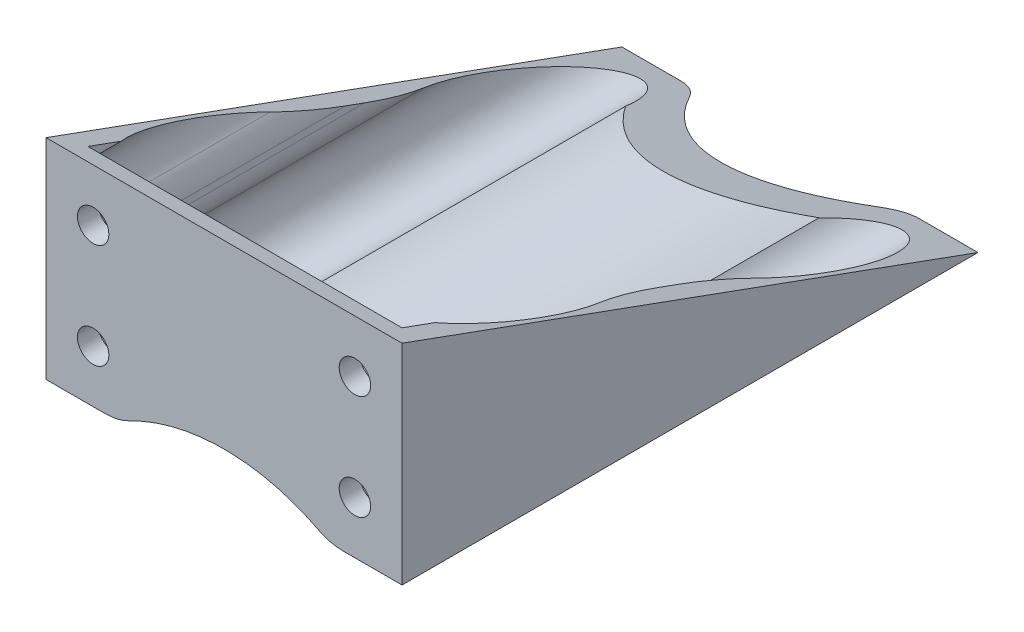
from build123d import *

# Parameters (mm, degrees)
SALIENTE_EXTRUIR3_DEPTH = 34
CROQUIS6_R              = 19.75
CORTAR_EXTRUIR2_DEPTH   = 68.683085036
VACIADO3_T              = -2
CROQUIS5_R              = 1.5
CORTAR_EXTRUIR3_DEPTH   = 10
REDONDEO1_R             = 5
REDONDEO3_R             = 5
CROQUIS10_R             = 4
CORTAR_EXTRUIR7_DEPTH   = 67.068146637
REDONDEO4_R             = 4


with BuildPart() as part:
    # Croquis4 → Saliente-Extruir3 (new body)
    with BuildSketch(Plane(origin=(0, 0, 0), x_dir=(0, 0, -1), z_dir=(1, 0, 0))):
        Polygon((0, 0), (55, 0), (0, 20), align=None)
    extrude(amount=SALIENTE_EXTRUIR3_DEPTH)

    # Croquis6 → Cortar-Extruir2 (cut, through all)
    with BuildSketch(Plane.XY):
        with Locations((17, -17)):
            Circle(CROQUIS6_R)
    extrude(amount=-CORTAR_EXTRUIR2_DEPTH, mode=Mode.SUBTRACT)

    # Vaciado3
    vaciado3_openings = [part.faces().sort_by_distance(p)[0] for p in [
        (17, 10.517691614, -26.076348062),
    ]]
    offset(amount=VACIADO3_T, openings=vaciado3_openings, kind=Kind.INTERSECTION)

    # Croquis5 → Cortar-Extruir3 (cut)
    with BuildSketch(Plane.XY):
        with Locations((4.5, 15)):
            Circle(CROQUIS5_R)
        with Locations((29.5, 15)):
            Circle(CROQUIS5_R)
        with Locations((29.5, 5)):
            Circle(CROQUIS5_R)
        with Locations((4.5, 5)):
            Circle(CROQUIS5_R)
    extrude(amount=-CORTAR_EXTRUIR3_DEPTH, mode=Mode.SUBTRACT)

    # Redondeo1
    redondeo1_edges = [part.edges().sort_by_distance(p)[0] for p in [
        (27.052984631, 0, -27.5),
        (6.947015369, 0, -27.5),
    ]]
    fillet(redondeo1_edges, radius=REDONDEO1_R)

    # Redondeo3
    redondeo3_edges = [part.edges().sort_by_distance(p)[0] for p in [
        (6.41404232, 2, -25.750000004),
        (27.58595768, 2, -25.75),
    ]]
    fillet(redondeo3_edges, radius=REDONDEO3_R)

    # Croquis10 → Cortar-Extruir7 (cut, through all)
    with BuildSketch(Plane(origin=(0, 0, -2), x_dir=(-1, 0, 0), z_dir=(0, 0, -1))):
        with Locations((-29.5, 15)):
            Circle(CROQUIS10_R)
        with Locations((-4.5, 15)):
            Circle(CROQUIS10_R)
        with Locations((-4.5, 5)):
            Circle(CROQUIS10_R)
        with Locations((-29.5, 5)):
            Circle(CROQUIS10_R)
    extrude(amount=CORTAR_EXTRUIR7_DEPTH, mode=Mode.SUBTRACT)

    # Redondeo4
    redondeo4_edges = [part.edges().sort_by_distance(p)[0] for p in [
        (2, 8.122498999, -17.331563876),
        (2, 11.877501001, -12.168436124),
        (32, 8.122498999, -17.331563876),
        (32, 11.877501001, -12.168436124),
    ]]
    fillet(redondeo4_edges, radius=REDONDEO4_R)


solid = part.part
